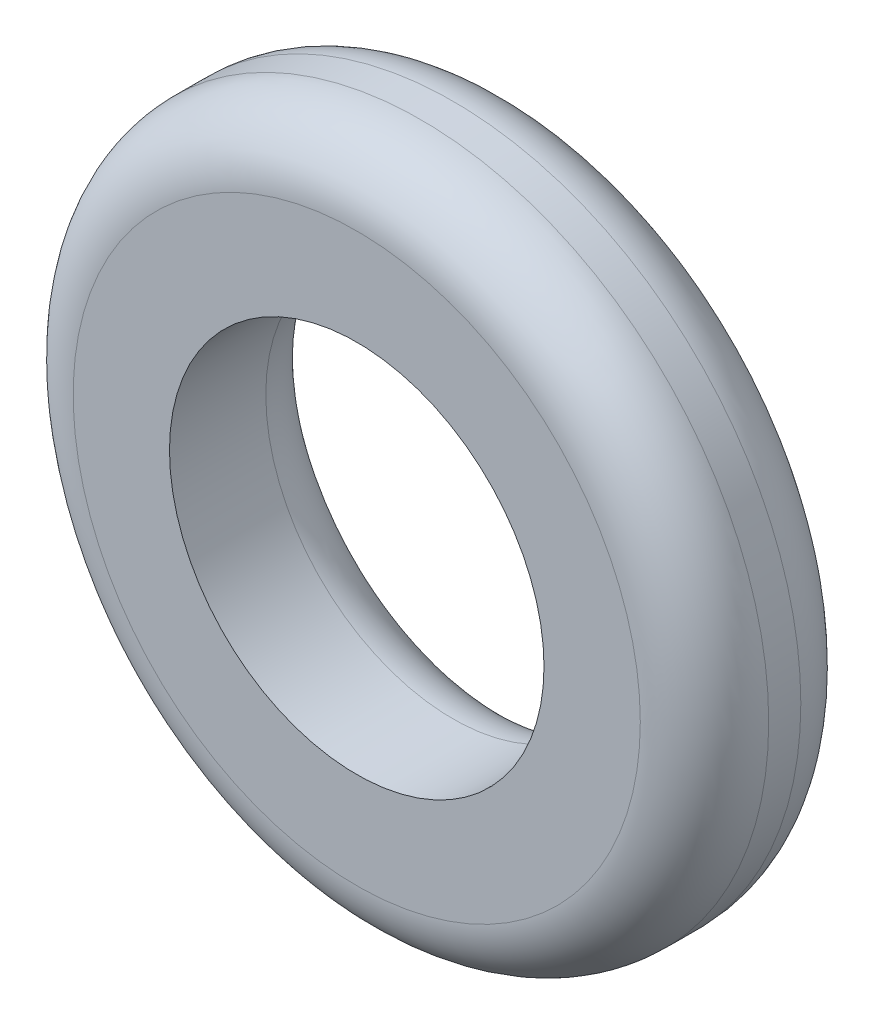
from build123d import *

# Parameters (mm, degrees)
SKETCH1_R           = 3.25
SKETCH1_R_2         = 1.75
BOSS_EXTRUDE1_DEPTH = 1.5
FILLET1_R           = 0.6


with BuildPart() as part:
    # Sketch1 → Boss-Extrude1 (new body)
    with BuildSketch(Plane.XY):
        Circle(SKETCH1_R)
        Circle(SKETCH1_R_2, mode=Mode.SUBTRACT)
    extrude(amount=BOSS_EXTRUDE1_DEPTH)

    # Fillet1
    fillet1_edges = [part.edges().sort_by_distance(p)[0] for p in [
        (-3.25, 0, 0),
        (-3.25, 0, 1.5),
        (-1.75, 0, 0),
    ]]
    fillet(fillet1_edges, radius=FILLET1_R)


solid = part.part
